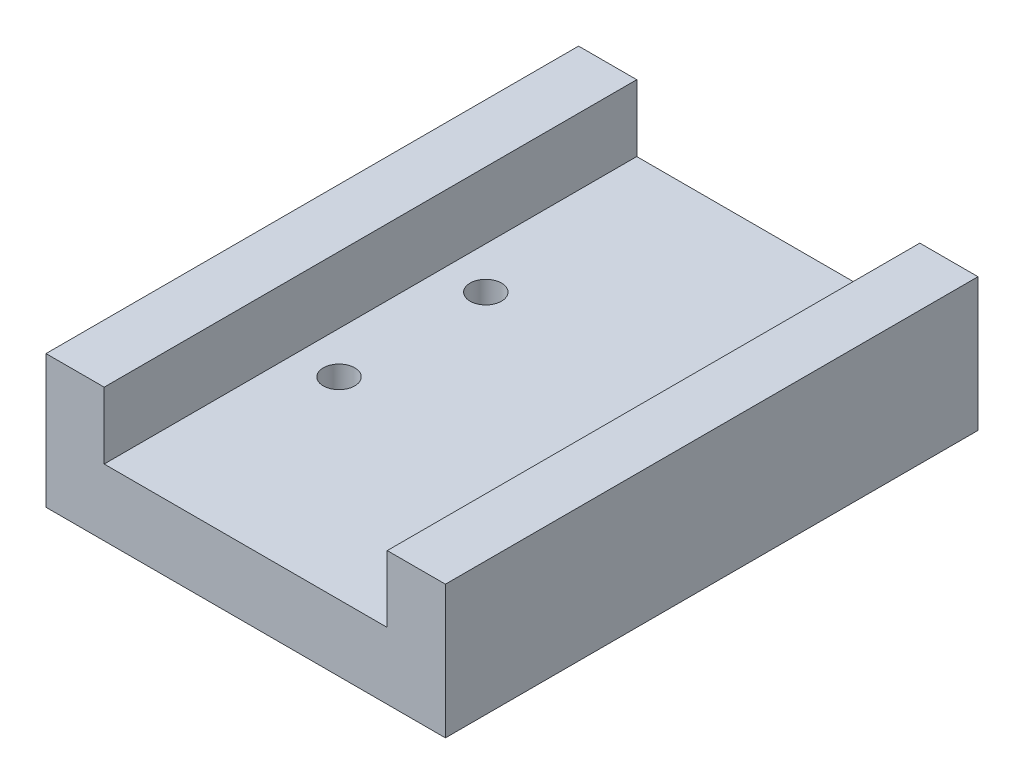
from build123d import *

# Parameters (mm, degrees)
SKETCH1_W           = 5.55
SKETCH1_H           = 6.35
SKETCH1_W_2         = 27
BOSS_EXTRUDE1_DEPTH = 50.8
SKETCH2_R           = 1.5
CUT_EXTRUDE1_DEPTH  = 56.72102386


with BuildPart() as part:
    # Sketch1 → Boss-Extrude1 (new body)
    with BuildSketch(Plane.XY):
        with Locations((-16.275, 9.525)):
            Rectangle(SKETCH1_W, SKETCH1_H)
        with Locations((-16.275, 3.175)):
            Rectangle(SKETCH1_W, SKETCH1_H)
        with Locations((0, 3.175)):
            Rectangle(SKETCH1_W_2, SKETCH1_H)
        with Locations((16.275, 9.525)):
            Rectangle(SKETCH1_W, SKETCH1_H)
        with Locations((16.275, 3.175)):
            Rectangle(SKETCH1_W, SKETCH1_H)
    extrude(amount=BOSS_EXTRUDE1_DEPTH)

    # Sketch2 → Cut-Extrude1 (cut, through all)
    with BuildSketch(Plane(origin=(0, 0, 0), x_dir=(1, 0, 0), z_dir=(0, 1, 0))):
        with Locations(Location((-9.5, -32.4, 0), (0, 0, 270))):
            Circle(SKETCH2_R)
        with Locations(Location((-9.5, -18.4, 0), (0, 0, 270))):
            Circle(SKETCH2_R)
    extrude(amount=CUT_EXTRUDE1_DEPTH, mode=Mode.SUBTRACT)


solid = part.part
